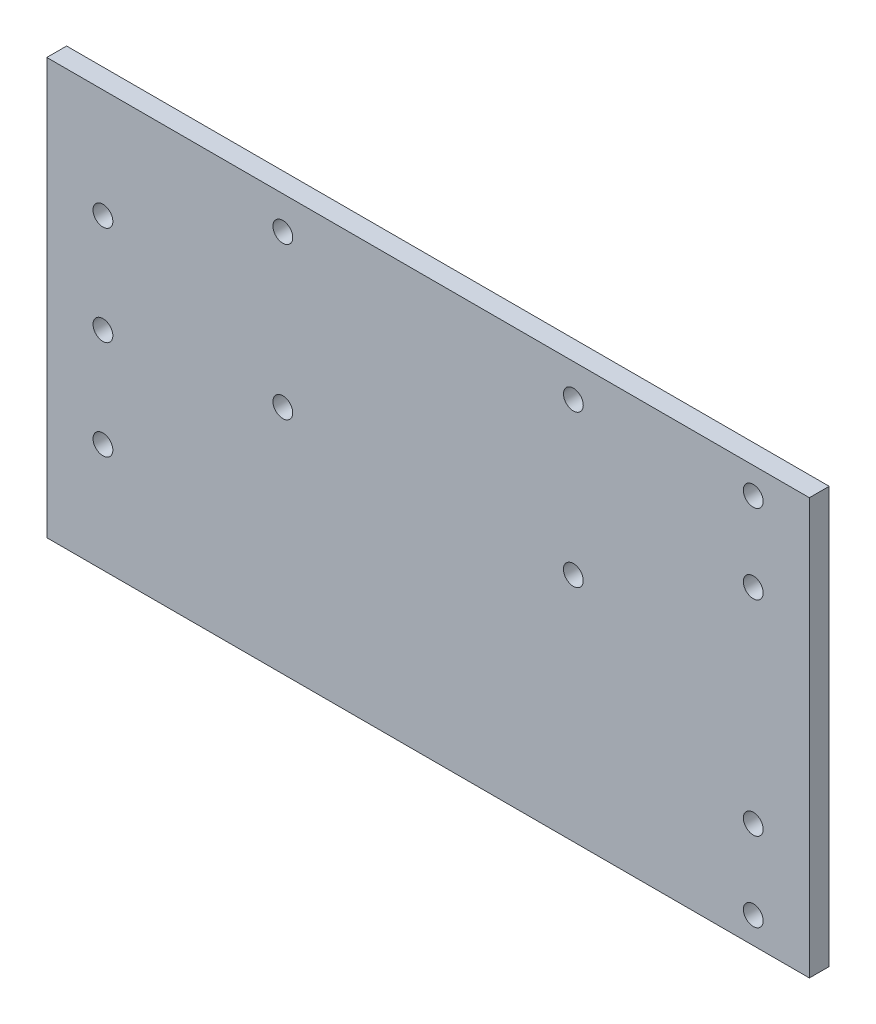
from build123d import *

# Parameters (mm, degrees)
SKETCH_1_W          = 115.5
SKETCH_1_H          = 63
EXTRUDE_1_DEPTH     = 3
SKETCH_2_R          = 1.5
CUT_EXTRUDE_1_DEPTH = 66.850683368
SKETCH_3_R          = 1.5
CUT_EXTRUDE_2_DEPTH = 66.850683368


with BuildPart() as part:
    # 草图1 → 凸台-拉伸1 (new body)
    with BuildSketch(Plane.XY):
        Rectangle(SKETCH_1_W, SKETCH_1_H)
    extrude(amount=EXTRUDE_1_DEPTH)

    # 草图2 → 切除-拉伸1 (cut, through all)
    with BuildSketch(Plane.XY.offset(3)):
        with Locations((49.25, 27.5)):
            Circle(SKETCH_2_R)
        with Locations((49.25, -27.5)):
            Circle(SKETCH_2_R)
        with Locations((49.25, 15.5)):
            Circle(SKETCH_2_R)
        with Locations((49.25, -15.5)):
            Circle(SKETCH_2_R)
        with Locations((-49.25, 0)):
            Circle(SKETCH_2_R)
        with Locations((-49.25, 15)):
            Circle(SKETCH_2_R)
        with Locations((-49.25, -15)):
            Circle(SKETCH_2_R)
    extrude(amount=-CUT_EXTRUDE_1_DEPTH, mode=Mode.SUBTRACT)

    # 草图3 → 切除-拉伸2 (cut, through all)
    with BuildSketch(Plane.XY.offset(3)):
        with Locations((-22, 26.5)):
            Circle(SKETCH_3_R)
        with Locations((22, 26.5)):
            Circle(SKETCH_3_R)
        with Locations((22, 3.5)):
            Circle(SKETCH_3_R)
        with Locations((-22, 3.5)):
            Circle(SKETCH_3_R)
    extrude(amount=-CUT_EXTRUDE_2_DEPTH, mode=Mode.SUBTRACT)


solid = part.part
